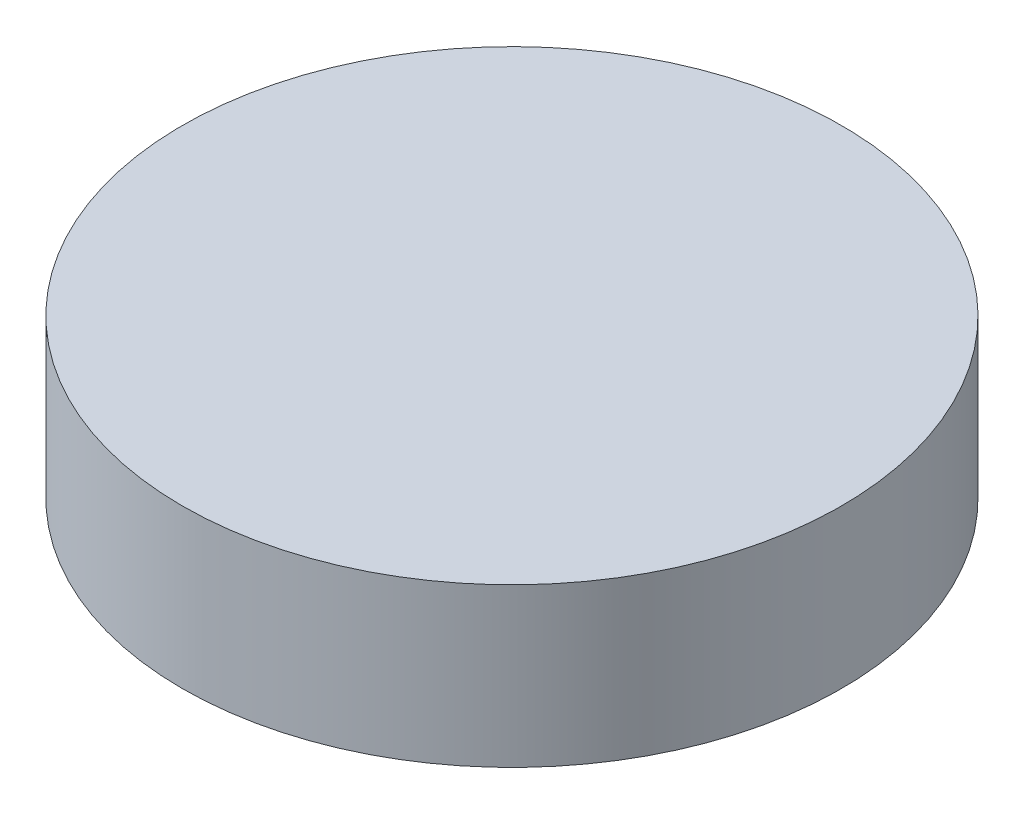
from build123d import *

# Parameters (mm, degrees)
SKETCH1_R               = 25
OVEN_AYAR_AYAGI_3_DEPTH = 12


with BuildPart() as part:
    # Sketch1 → OVEN_ayar_ayagi_3 (new body)
    with BuildSketch(Plane(origin=(0, 0, 0), x_dir=(1, 0, 0), z_dir=(0, 1, 0))):
        with Locations(Location((50, 770, 0), (0, 0, 270))):
            Circle(SKETCH1_R)
    extrude(amount=OVEN_AYAR_AYAGI_3_DEPTH)


solid = part.part
